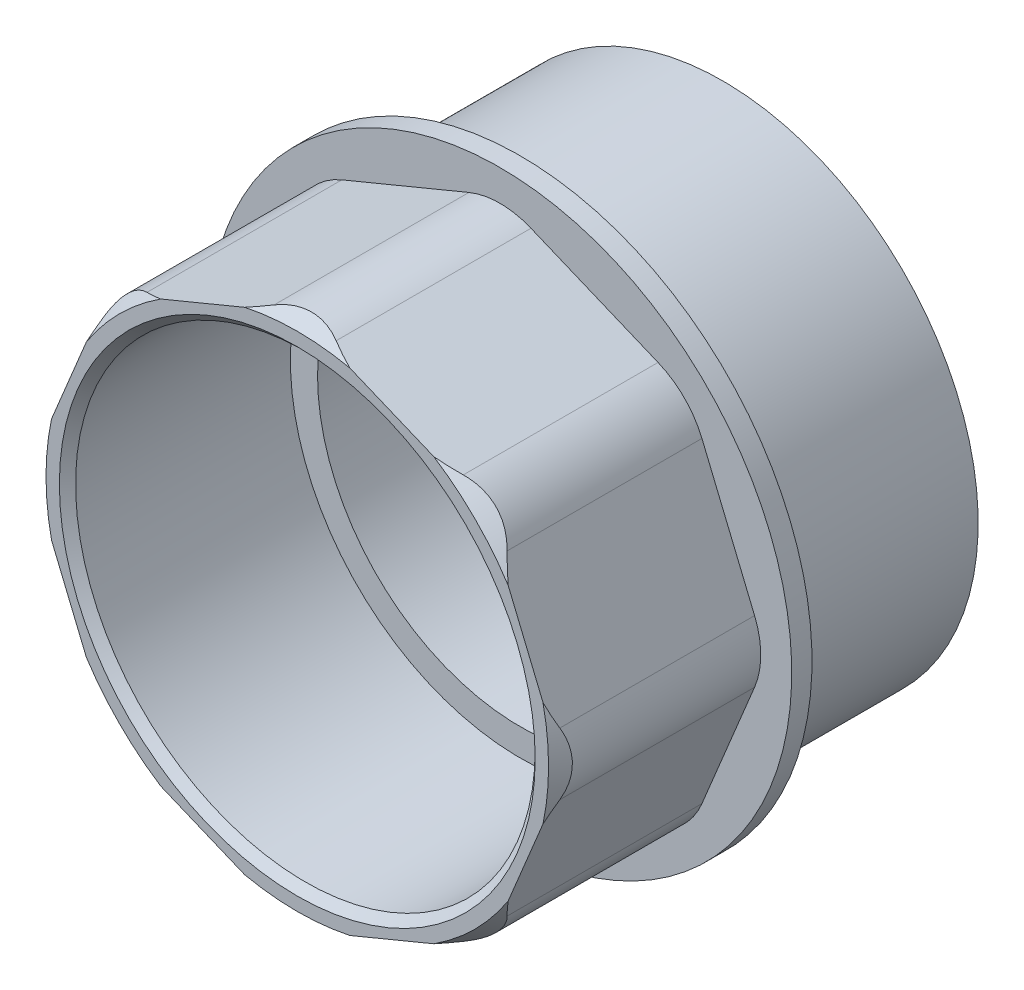
from build123d import *

# Parameters (mm, degrees)
SZKIC1_R                    = 33
DODANIE_WYCI_GNI_CIE1_DEPTH = 25
SZKIC2_R                    = 36
DODANIE_WYCI_GNI_CIE2_DEPTH = 2.5
SZKIC4_R                    = 31.5
DODANIE_WYCI_GNI_CIE3_DEPTH = 25
SZKIC11_R                   = 28.35
WYTNIJ_WYCI_GNI_CIE5_DEPTH  = 27.5
SZKIC12_R                   = 25
WYTNIJ_WYCI_GNI_CIE6_DEPTH  = 27.5
WYTNIJ_WYCI_GNI_CIE7_START  = -8
SZKIC13_R                   = 28.35
WYTNIJ_WYCI_GNI_CIE7_DEPTH  = 8
SFAZOWANIE1_SIZE            = 1
SFAZOWANIE2_SIZE            = 1
WYTNIJ_WYCI_GNI_CIE11_DEPTH = 25
ZAOKR_GLENIE1_R             = 10


with BuildPart() as part:
    # Szkic1 → Dodanie-wyciągnięcie1 (new body)
    with BuildSketch(Plane.XY):
        Circle(SZKIC1_R)
    extrude(amount=-DODANIE_WYCI_GNI_CIE1_DEPTH)

    # Szkic2 → Dodanie-wyciągnięcie2 (add)
    with BuildSketch(Plane(origin=(0, 0, -25), x_dir=(-1, 0, 0), z_dir=(0, 0, -1))):
        Circle(SZKIC2_R)
    extrude(amount=DODANIE_WYCI_GNI_CIE2_DEPTH)

    # Szkic4 → Dodanie-wyciągnięcie3 (add)
    with BuildSketch(Plane(origin=(0, 0, -27.5), x_dir=(-1, 0, 0), z_dir=(0, 0, -1))):
        Circle(SZKIC4_R)
    extrude(amount=DODANIE_WYCI_GNI_CIE3_DEPTH)

    # Szkic11 → Wytnij-wyciągnięcie5 (cut)
    with BuildSketch(Plane.XY):
        Circle(SZKIC11_R)
    extrude(amount=-WYTNIJ_WYCI_GNI_CIE5_DEPTH, mode=Mode.SUBTRACT)

    # Szkic12 → Wytnij-wyciągnięcie6 (cut)
    with BuildSketch(Plane.XY.offset(-27.5)):
        Circle(SZKIC12_R)
    extrude(amount=-WYTNIJ_WYCI_GNI_CIE6_DEPTH, mode=Mode.SUBTRACT)

    # Szkic13 → Wytnij-wyciągnięcie7 (cut)
    with BuildSketch(Plane(origin=(0, 0, -52.5), x_dir=(-1, 0, 0), z_dir=(0, 0, -1)).offset(WYTNIJ_WYCI_GNI_CIE7_START)):
        with Locations(Location((0, 0, 0), (0, 0, 180))):
            Circle(SZKIC13_R)
    extrude(amount=WYTNIJ_WYCI_GNI_CIE7_DEPTH, mode=Mode.SUBTRACT)

    # Sfazowanie1
    sfazowanie1_edges = [part.edges().sort_by_distance(p)[0] for p in [
        (-28.35, 0, 0),
    ]]
    chamfer(sfazowanie1_edges, length=SFAZOWANIE1_SIZE)

    # Sfazowanie2
    sfazowanie2_edges = [part.edges().sort_by_distance(p)[0] for p in [
        (-28.35, 0, -52.5),
    ]]
    chamfer(sfazowanie2_edges, length=SFAZOWANIE2_SIZE)

    # Szkic10 → Wytnij-wyciągnięcie11 (cut)
    with BuildSketch(Plane.XY):
        with BuildLine():
            Line((-23.334523779, -23.334523779), (-33, 0))
            ThreePointArc((-33, 0), (-30.488024573, -12.628553268), (-23.334523779, -23.334523779))
        make_face()
        with BuildLine():
            Line((-33, 0), (-23.334523779, 23.334523779))
            ThreePointArc((-23.334523779, 23.334523779), (-30.488024573, 12.628553268), (-33, 0))
        make_face()
        with BuildLine():
            Line((0, -33), (-23.334523779, -23.334523779))
            ThreePointArc((-23.334523779, -23.334523779), (-12.628553268, -30.488024573), (0, -33))
        make_face()
        with BuildLine():
            ThreePointArc((0, -33), (12.628553268, -30.488024573), (23.334523779, -23.334523779))
            Line((23.334523779, -23.334523779), (0, -33))
        make_face()
        with BuildLine():
            ThreePointArc((23.334523779, -23.334523779), (30.488024573, -12.628553268), (33, 0))
            Line((33, 0), (23.334523779, -23.334523779))
        make_face()
        with BuildLine():
            ThreePointArc((33, 0), (30.488024573, 12.628553268), (23.334523779, 23.334523779))
            Line((23.334523779, 23.334523779), (33, 0))
        make_face()
        with BuildLine():
            ThreePointArc((23.334523779, 23.334523779), (12.628553268, 30.488024573), (0, 33))
            Line((0, 33), (23.334523779, 23.334523779))
        make_face()
        with BuildLine():
            Line((-23.334523779, 23.334523779), (0, 33))
            ThreePointArc((0, 33), (-12.628553268, 30.488024573), (-23.334523779, 23.334523779))
        make_face()
    extrude(amount=-WYTNIJ_WYCI_GNI_CIE11_DEPTH, mode=Mode.SUBTRACT)

    # Szkic14 → Wycięcie-obrót3 (revolve, cut)
    with BuildSketch(Plane(origin=(0, 0, 0), x_dir=(0, 0, -1), z_dir=(1, 0, 0)), mode=Mode.PRIVATE) as wyci_cie_obr_t3_sk:
        Polygon((0, 33), (0, 31), (3, 33), align=None)
    revolve(wyci_cie_obr_t3_sk.sketch.rotate(Axis((0, 0, 0), (0, 0, -1)), 270), axis=Axis((0, 0, 0), (0, 0, -1)), mode=Mode.SUBTRACT)

    # Zaokrąglenie1
    zaokr_glenie1_edges = [part.edges().sort_by_distance(p)[0] for p in [
        (-23.334523779, 23.334523779, -14),
        (0, 33, -14),
        (23.334523779, 23.334523779, -14),
        (33, 0, -14),
        (23.334523779, -23.334523779, -14),
        (0, -33, -14),
        (-23.334523779, -23.334523779, -14),
        (-33, 0, -14),
    ]]
    fillet(zaokr_glenie1_edges, radius=ZAOKR_GLENIE1_R)


solid = part.part
